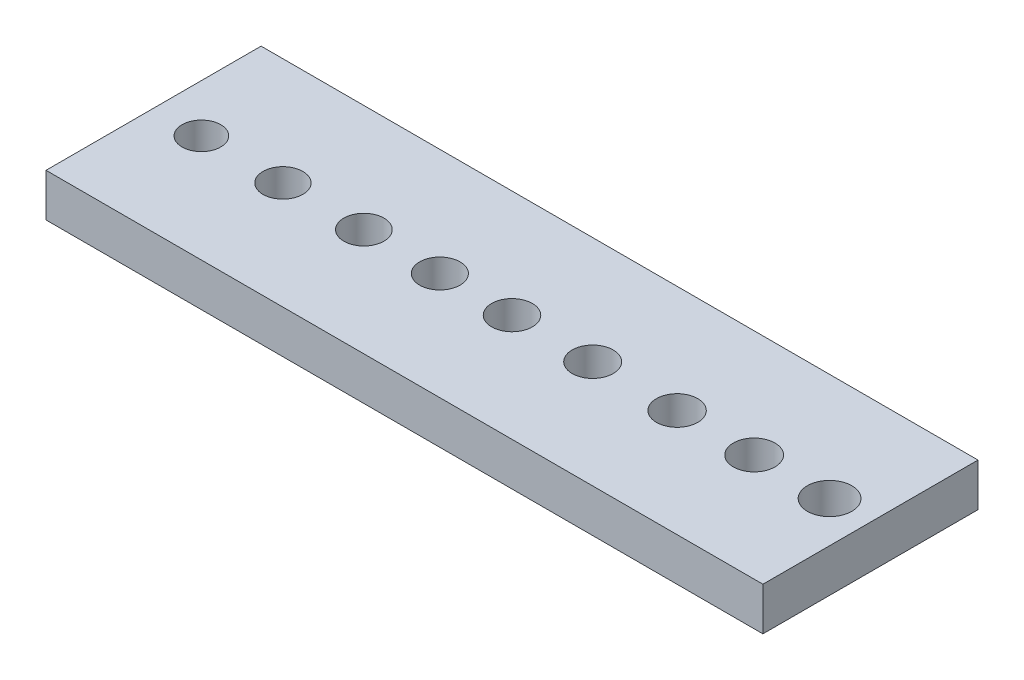
from build123d import *

# Parameters (mm, degrees)
CROQUIS1_W                         = 50
CROQUIS1_H                         = 15
CROQUIS1_R                         = 1.35
CROQUIS1_R_2                       = 1.39
CROQUIS1_R_3                       = 1.4
CROQUIS1_R_4                       = 1.41
CROQUIS1_R_5                       = 1.42
CROQUIS1_R_6                       = 1.43
CROQUIS1_R_7                       = 1.44
CROQUIS1_R_8                       = 1.45
SALIENTE_EXTRUIR1_DEPTH            = 3
TALADRO_DE_MARGEN_PARA_M2_51_D     = 3.1
TALADRO_DE_MARGEN_PARA_M2_51_DEPTH = 3.18
TALADRO_DE_MARGEN_PARA_M2_51_TIP   = 0.931333959


with BuildPart() as part:
    # Croquis1 → Saliente-Extruir1 (new body)
    with BuildSketch(Plane(origin=(0, 0, 0), x_dir=(1, 0, 0), z_dir=(0, 1, 0))):
        Rectangle(CROQUIS1_W, CROQUIS1_H)
        with Locations(Location((-21.662668198, 0, 0), (0, 0, 270))):
            Circle(CROQUIS1_R, mode=Mode.SUBTRACT)
        with Locations(Location((-15.977400582, 0, 0), (0, 0, 270))):
            Circle(CROQUIS1_R_2, mode=Mode.SUBTRACT)
        with Locations(Location((-10.330808256, 0, 0), (0, 0, 270))):
            Circle(CROQUIS1_R_3, mode=Mode.SUBTRACT)
        with Locations(Location((-5.032293538, 0, 0), (0, 0, 270))):
            Circle(CROQUIS1_R_4, mode=Mode.SUBTRACT)
        with Locations(Location((0, 0, 0), (0, 0, 270))):
            Circle(CROQUIS1_R_5, mode=Mode.SUBTRACT)
        with Locations(Location((5.626588796, 0, 0), (0, 0, 270))):
            Circle(CROQUIS1_R_6, mode=Mode.SUBTRACT)
        with Locations(Location((11.516395661, 0, 0), (0, 0, 270))):
            Circle(CROQUIS1_R_7, mode=Mode.SUBTRACT)
        with Locations(Location((16.88744942, 0, 0), (0, 0, 270))):
            Circle(CROQUIS1_R_8, mode=Mode.SUBTRACT)
    extrude(amount=SALIENTE_EXTRUIR1_DEPTH)

    # Taladro de margen para M2.51
    with Locations(Plane(origin=(0, 3, 0), x_dir=(1, 0, 0), z_dir=(0, 1, 0))):
        with Locations((22.148927614, 0)):
            Hole(TALADRO_DE_MARGEN_PARA_M2_51_D / 2, depth=TALADRO_DE_MARGEN_PARA_M2_51_DEPTH)
            with Locations((0, 0, -(TALADRO_DE_MARGEN_PARA_M2_51_DEPTH + TALADRO_DE_MARGEN_PARA_M2_51_TIP / 2))):  # 118° drill point
                Cone(0, TALADRO_DE_MARGEN_PARA_M2_51_D / 2, TALADRO_DE_MARGEN_PARA_M2_51_TIP, mode=Mode.SUBTRACT)


solid = part.part
